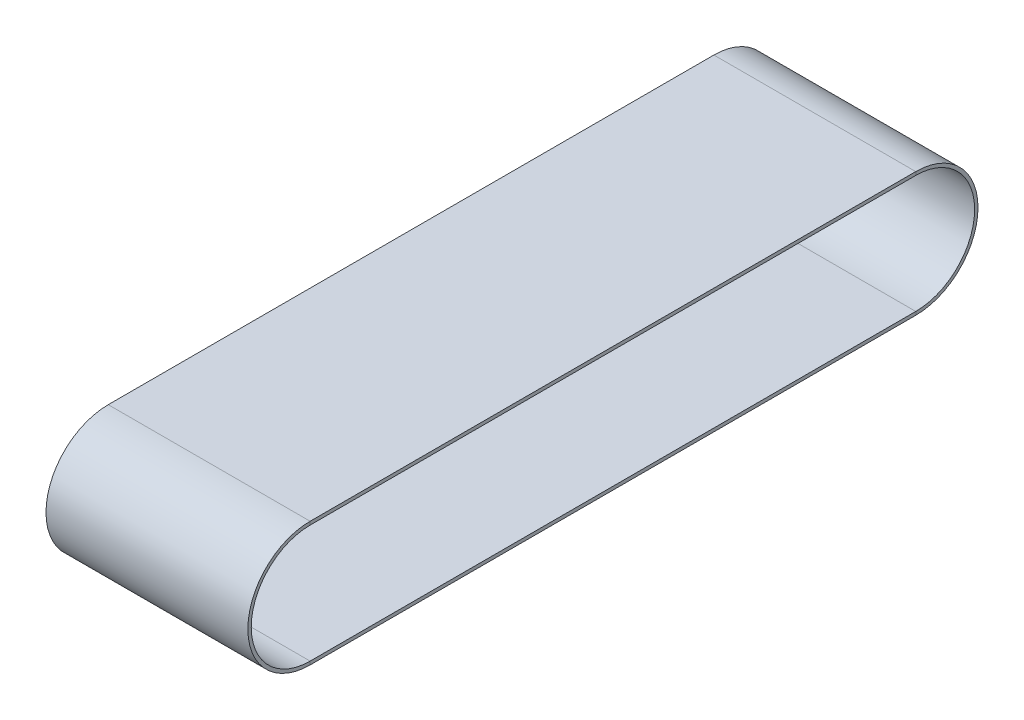
from build123d import *

# Parameters (mm, degrees)
SKETCH1_W = 152.4
SKETCH1_H = 2.54


with BuildPart() as part:
    # Sweep1: sweep along a path in Sketch2
    with BuildLine(Plane(origin=(0, 0, 0), x_dir=(0, 0, -1), z_dir=(1, 0, 0))) as sweep1_path:
        Line((0, 45.72), (457.2, 45.72))
        ThreePointArc((457.2, 45.72), (502.92, 0), (457.2, -45.72))
        Line((457.2, -45.72), (0, -45.72))
        ThreePointArc((0, -45.72), (-45.72, 0), (0, 45.72))
    # Sketch1 → Sweep1 (sweep)
    with BuildSketch(Plane.XY):
        with Locations((0, 45.72)):
            Rectangle(SKETCH1_W, SKETCH1_H)
    sweep(path=sweep1_path.line)


solid = part.part
